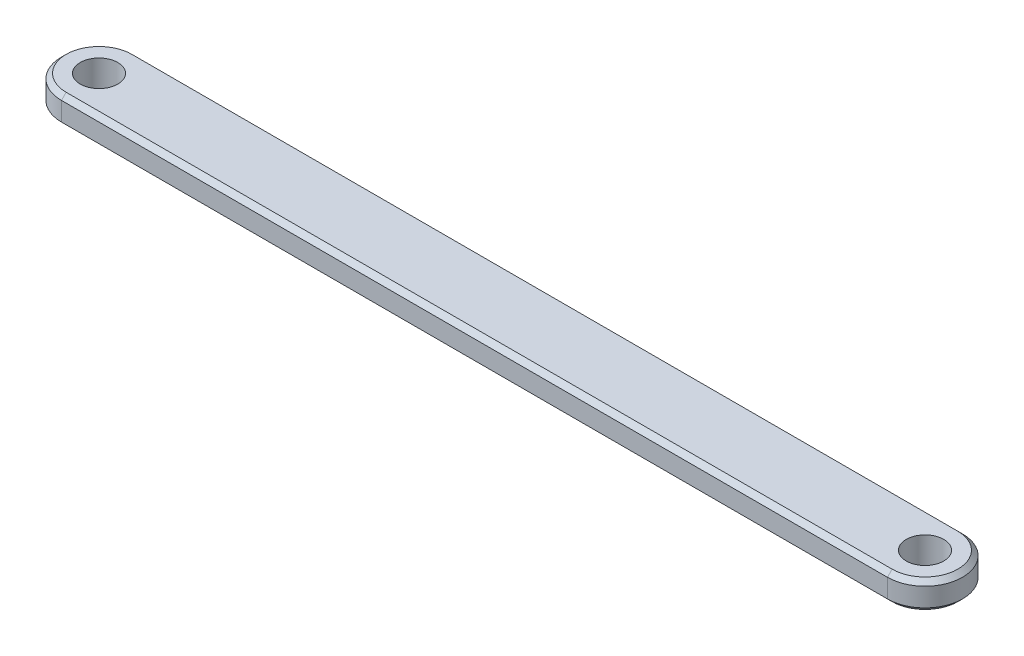
from build123d import *

# Parameters (mm, degrees)
SKETCH1_R           = 2
BOSS_EXTRUDE1_DEPTH = 1.5
CHAMFER1_SIZE       = 0.5


with BuildPart() as part:
    # Sketch1 → Boss-Extrude1 (new, symmetric)
    with BuildSketch(Plane(origin=(0, 0, 0), x_dir=(1, 0, 0), z_dir=(0, 1, 0))):
        with BuildLine():
            Line((0, 4), (88, 4))
            ThreePointArc((88, 4), (92, 0), (88, -4))
            Line((88, -4), (0, -4))
            ThreePointArc((0, -4), (-4, 0), (0, 4))
        make_face()
        with Locations(Location((0, 0, 0), (0, 0, 270))):
            Circle(SKETCH1_R, mode=Mode.SUBTRACT)
        with Locations(Location((88, 0, 0), (0, 0, 270))):
            Circle(SKETCH1_R, mode=Mode.SUBTRACT)
    extrude(amount=BOSS_EXTRUDE1_DEPTH, both=True)

    # Chamfer1
    chamfer1_edges = [part.edges().sort_by_distance(p)[0] for p in [
        (92, 1.5, 0),
        (44, 1.5, -4),
        (-4, 1.5, 0),
        (44, -1.5, -4),
        (92, -1.5, 0),
        (44, -1.5, 4),
        (-4, -1.5, 0),
        (44, 1.5, 4),
    ]]
    chamfer(chamfer1_edges, length=CHAMFER1_SIZE)


solid = part.part
